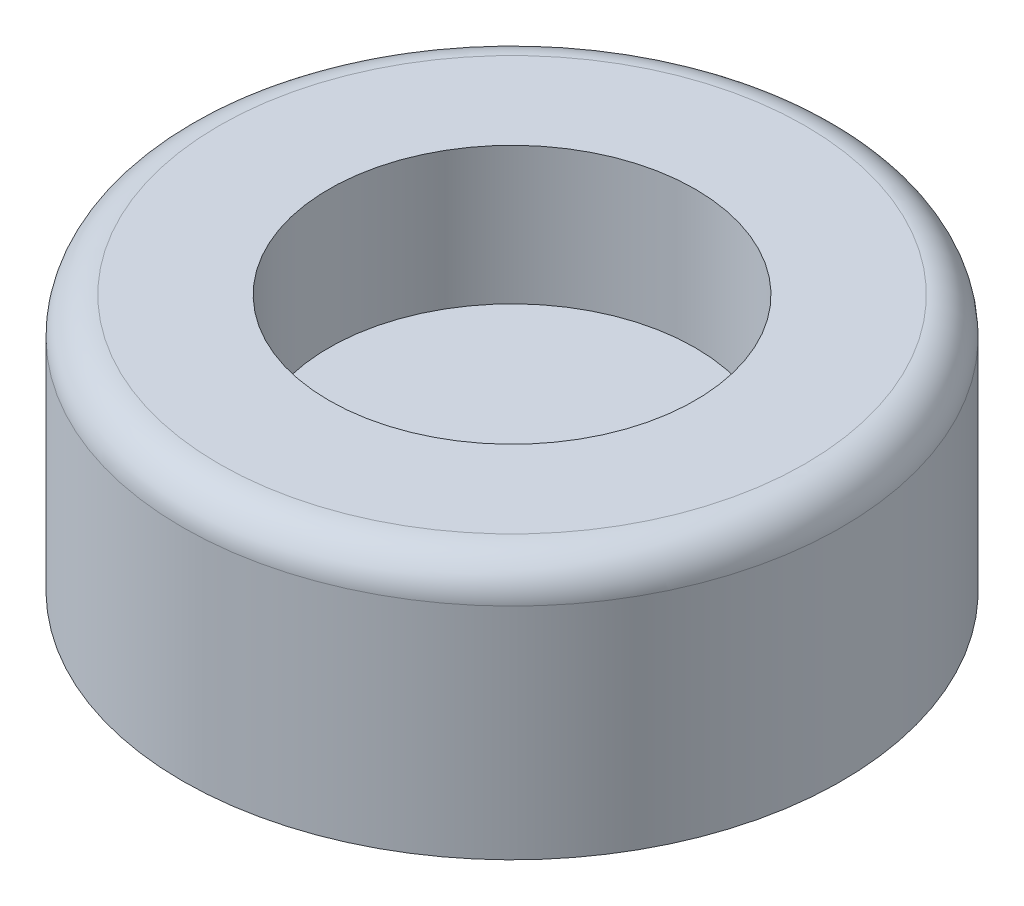
from build123d import *

# Parameters (mm, degrees)
SKETCH1_R           = 11.43
BOSS_EXTRUDE1_DEPTH = 8.89
SKETCH2_R           = 6.35
CUT_EXTRUDE1_DEPTH  = 4.7625
FILLET4_R           = 1.27
SKETCH3_R           = 3.175
CUT_EXTRUDE2_DEPTH  = 2.54


with BuildPart() as part:
    # Sketch1 → Boss-Extrude1 (new body)
    with BuildSketch(Plane(origin=(0, 0, 0), x_dir=(1, 0, 0), z_dir=(0, 1, 0))):
        Circle(SKETCH1_R)
    extrude(amount=BOSS_EXTRUDE1_DEPTH)

    # Sketch2 → Cut-Extrude1 (cut)
    with BuildSketch(Plane(origin=(0, 8.89, 0), x_dir=(1, 0, 0), z_dir=(0, 1, 0))):
        Circle(SKETCH2_R)
    extrude(amount=-CUT_EXTRUDE1_DEPTH, mode=Mode.SUBTRACT)

    # Fillet4
    fillet4_edges = [part.edges().sort_by_distance(p)[0] for p in [
        (-11.43, 8.89, 0),
    ]]
    fillet(fillet4_edges, radius=FILLET4_R)

    # Sketch3 → Cut-Extrude2 (cut)
    with BuildSketch(Plane.XZ):
        Circle(SKETCH3_R)
    extrude(amount=-CUT_EXTRUDE2_DEPTH, mode=Mode.SUBTRACT)


solid = part.part
